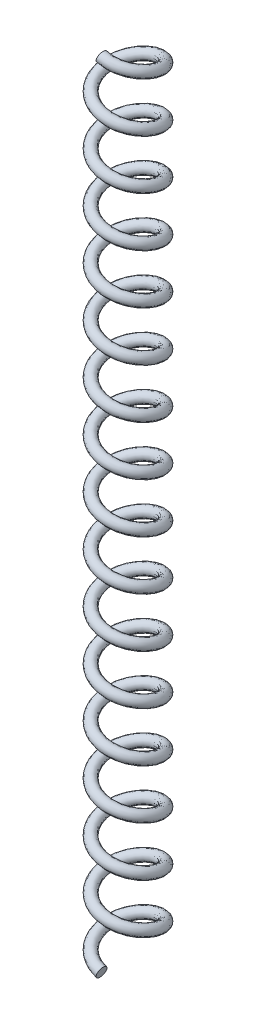
from build123d import *

# Parameters (mm, degrees)
COIL_WIRE_PITCH     = 4.6875
COIL_WIRE_HEIGHT    = 75
COIL_WIRE_RADIUS    = 2.5
COIL_WIRE_PROFILE_R = 0.5


with BuildPart() as part:
    # Coil_Wire: sweep along a helix
    with BuildLine() as coil_wire_path:
        Helix(COIL_WIRE_PITCH, COIL_WIRE_HEIGHT, COIL_WIRE_RADIUS, center=(0, 0, 0), direction=(0, 1, 0), lefthand=True)
    # Coil_Wire profile (on start of the path) → Coil_Wire (sweep)
    with BuildSketch(Plane(origin=(0, 0, 2.5), x_dir=(-0.28595462872094096, -0.9582431582396344, 0), z_dir=(-0.9582431582396344, 0.28595462872094096, 1.7212895241820196e-13))):
        Circle(COIL_WIRE_PROFILE_R)
    sweep(path=coil_wire_path.line, is_frenet=True)


solid = part.part
